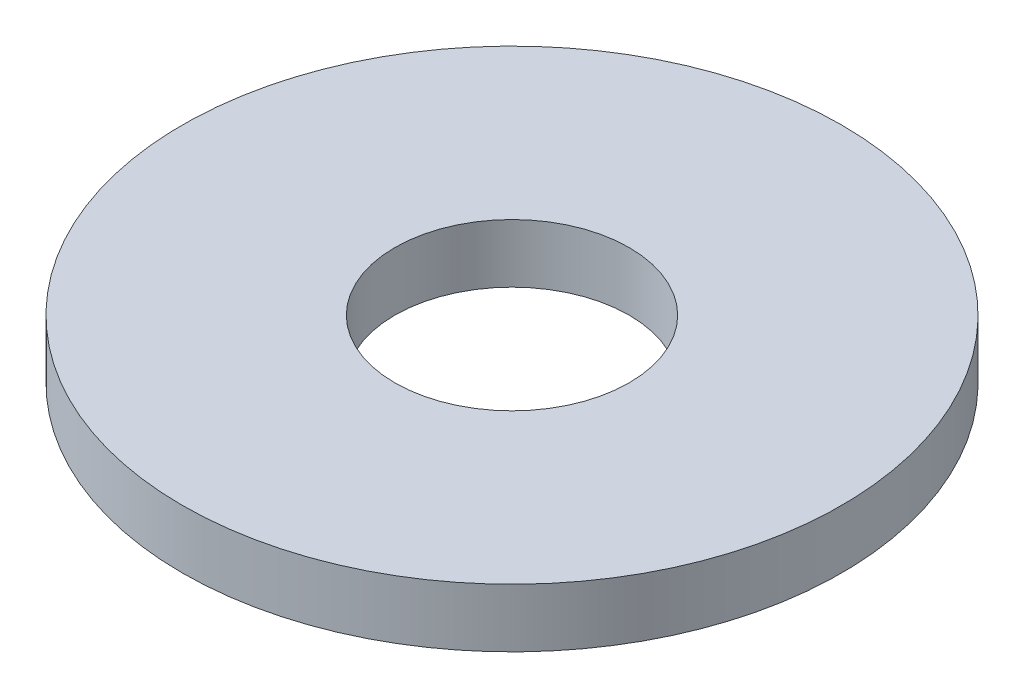
from build123d import *

# Parameters (mm, degrees)
SKETCH1_R           = 9
SKETCH1_R_2         = 3.2
BOSS_EXTRUDE1_DEPTH = 1.6


with BuildPart() as part:
    # Sketch1 → Boss-Extrude1 (new body)
    with BuildSketch(Plane(origin=(0, 0, 0), x_dir=(1, 0, 0), z_dir=(0, 1, 0))):
        with Locations(Location((0, 0, 0), (0, 0, 270))):
            Circle(SKETCH1_R)
        with Locations(Location((0, 0, 0), (0, 0, 270))):
            Circle(SKETCH1_R_2, mode=Mode.SUBTRACT)
    extrude(amount=BOSS_EXTRUDE1_DEPTH)


solid = part.part
